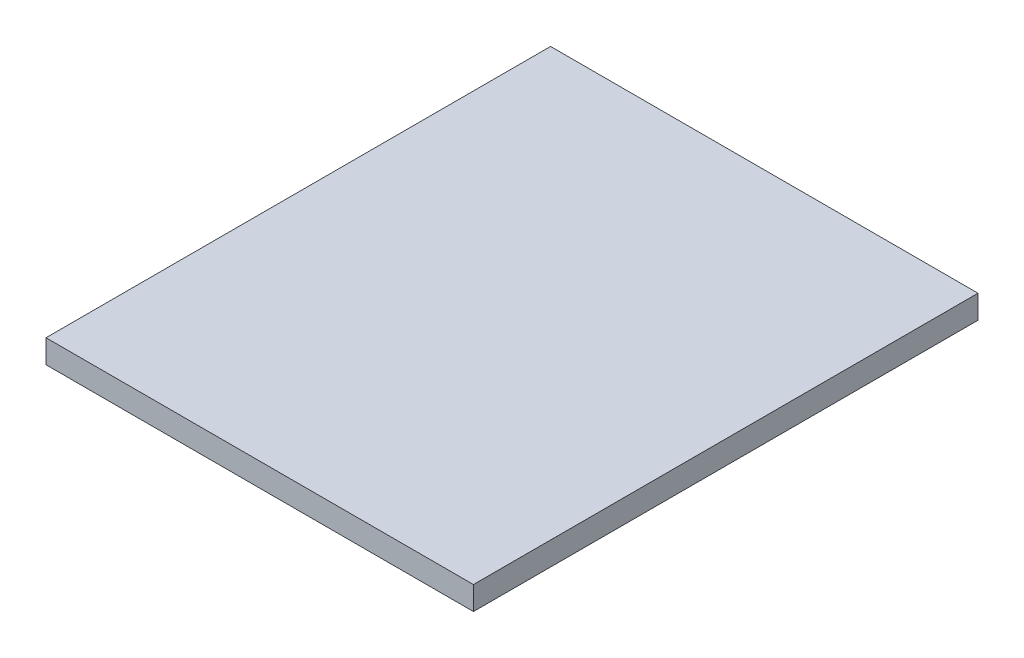
from build123d import *

# Parameters (mm, degrees)
SKETCH1_W           = 46.34348767
SKETCH1_H           = 54.704426166
BOSS_EXTRUDE1_DEPTH = 2.54


with BuildPart() as part:
    # Sketch1 → Boss-Extrude1 (new body)
    with BuildSketch(Plane(origin=(0, 0, 0), x_dir=(1, 0, 0), z_dir=(0, 1, 0))):
        Rectangle(SKETCH1_W, SKETCH1_H)
    extrude(amount=BOSS_EXTRUDE1_DEPTH)


solid = part.part
